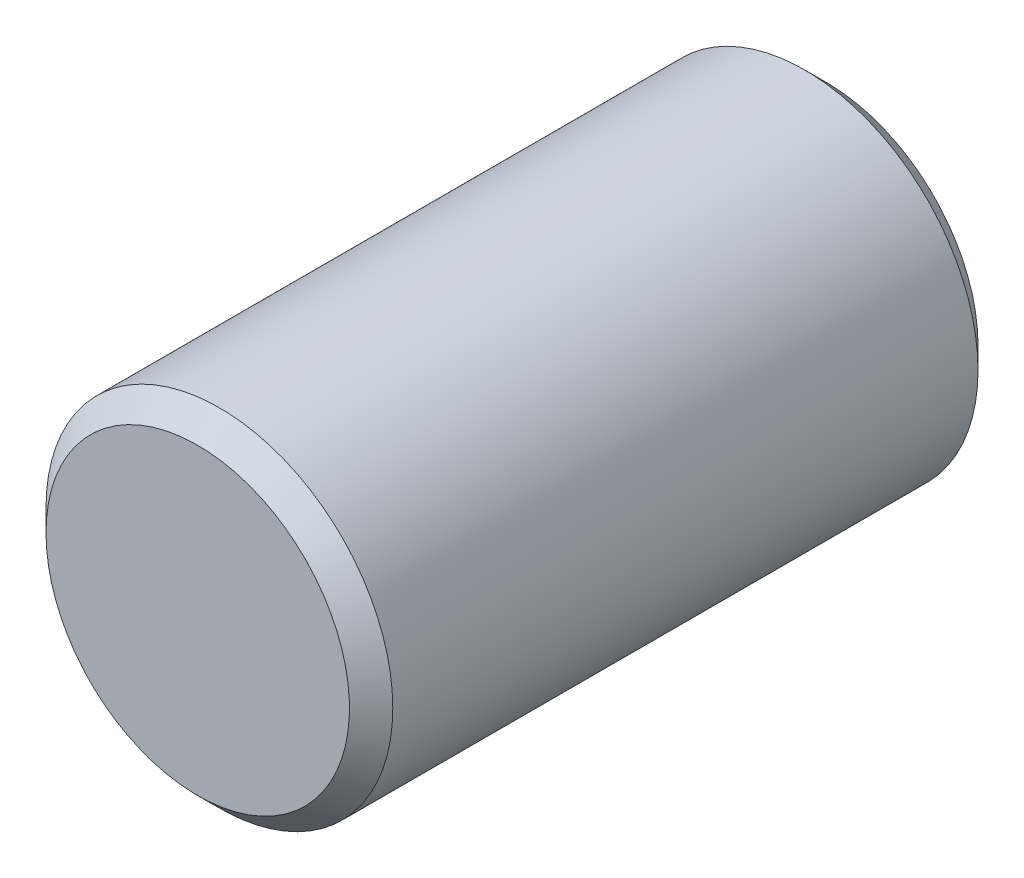
from build123d import *

# Parameters (mm, degrees)
SKETCH1_W     = 14.5
SKETCH1_H     = 4
CHAMFER1_SIZE = 0.5


with BuildPart() as part:
    # Sketch1 → Revolve1 (revolve)
    with BuildSketch(Plane(origin=(0, 0, 0), x_dir=(0, 0, -1), z_dir=(1, 0, 0)), mode=Mode.PRIVATE) as revolve1_sk:
        with Locations((7.25, 2)):
            Rectangle(SKETCH1_W, SKETCH1_H)
    revolve(revolve1_sk.sketch.rotate(Axis((0, 0, 0), (0, 0, -1)), 90), axis=Axis((0, 0, 0), (0, 0, -1)))

    # Chamfer1
    chamfer1_edges = [part.edges().sort_by_distance(p)[0] for p in [
        (-4, 0, -14.5),
        (-4, 0, 0),
    ]]
    chamfer(chamfer1_edges, length=CHAMFER1_SIZE)


solid = part.part
